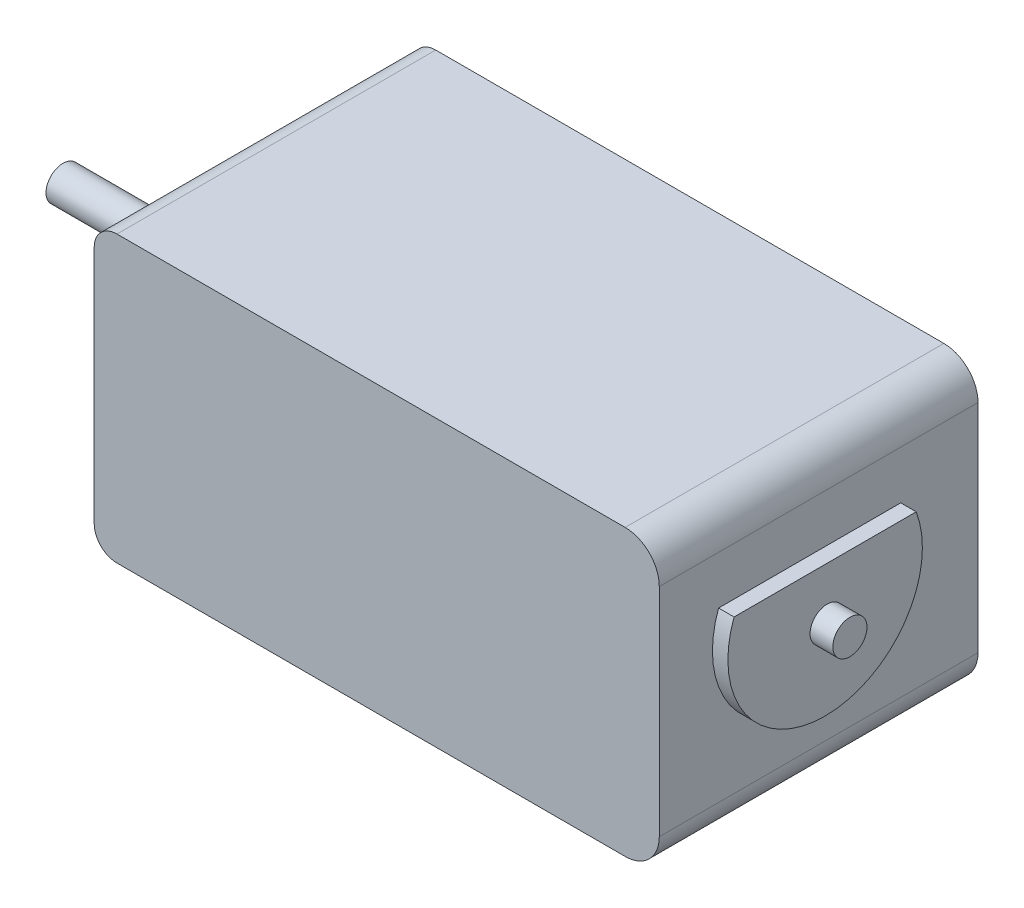
from build123d import *

# Parameters (mm, degrees)
BOSS_EXTRUDE1_DEPTH = 14
SKETCH2_R           = 2.5
SKETCH2_R_2         = 2.25
BOSS_EXTRUDE3_DEPTH = 1.5
SKETCH3_R           = 0.75
BOSS_EXTRUDE4_DEPTH = 8
BOSS_EXTRUDE5_DEPTH = 25.5
SKETCH8_R           = 0.75
BOSS_EXTRUDE7_DEPTH = 1
SKETCH9_R           = 0.75
BOSS_EXTRUDE8_DEPTH = 1


with BuildPart() as part:
    # Sketch1 → Boss-Extrude1 (new body)
    with BuildSketch(Plane.XY):
        with BuildLine():
            Line((1, 0), (23.320898327, 0))
            ThreePointArc((23.320898327, 0), (24.381558498, -0.439339828), (24.820898327, -1.5))
            Line((24.820898327, -1.5), (24.820898327, -11.016992716))
            ThreePointArc((24.820898327, -11.016992716), (24.381558498, -12.077652887), (23.320898327, -12.516992716))
            Line((23.320898327, -12.516992716), (1, -12.516992716))
            ThreePointArc((1, -12.516992716), (0.292893219, -12.224099497), (0, -11.516992716))
            Line((0, -11.516992716), (0, -1))
            ThreePointArc((0, -1), (0.292893219, -0.292893219), (1, 0))
        make_face()
    extrude(amount=BOSS_EXTRUDE1_DEPTH)

    # Sketch2 → Boss-Extrude3 (add)
    with BuildSketch(Plane(origin=(0, 0, 0), x_dir=(0, 0, -1), z_dir=(1, 0, 0))):
        with Locations((-7.367821443, -5.872283843)):
            Circle(SKETCH2_R)
        with Locations((-7.367821443, -5.872283843)):
            Circle(SKETCH2_R_2, mode=Mode.SUBTRACT)
    extrude(amount=-BOSS_EXTRUDE3_DEPTH)

    # Sketch3 → Boss-Extrude4 (add)
    with BuildSketch(Plane.ZY):
        with Locations(Location((7.367821443, -5.872283843, 0), (0, 0, 180))):
            Circle(SKETCH3_R)
    extrude(amount=BOSS_EXTRUDE4_DEPTH)

    # Sketch7 → Boss-Extrude5 (add)
    with BuildSketch(Plane(origin=(0, 0, 0), x_dir=(0, 0, -1), z_dir=(1, 0, 0))):
        with BuildLine():
            Line((-11.394447379, -3.62022901), (-3.393359944, -3.62022901))
            ThreePointArc((-3.393359944, -3.62022901), (-7.393903662, -9.38997212), (-11.394447379, -3.62022901))
        make_face()
    extrude(amount=BOSS_EXTRUDE5_DEPTH)

    # Sketch8 → Boss-Extrude7 (add)
    with BuildSketch(Plane(origin=(25.5, 0, 0), x_dir=(0, 0, -1), z_dir=(1, 0, 0))):
        with Locations((-7.348346706, -5.904616391)):
            Circle(SKETCH8_R)
    extrude(amount=-BOSS_EXTRUDE7_DEPTH)

    # Sketch9 → Boss-Extrude8 (add)
    with BuildSketch(Plane(origin=(25.5, 0, 0), x_dir=(0, 0, -1), z_dir=(1, 0, 0))):
        with Locations((-7.305909656, -5.926147043)):
            Circle(SKETCH9_R)
    extrude(amount=BOSS_EXTRUDE8_DEPTH)


solid = part.part
